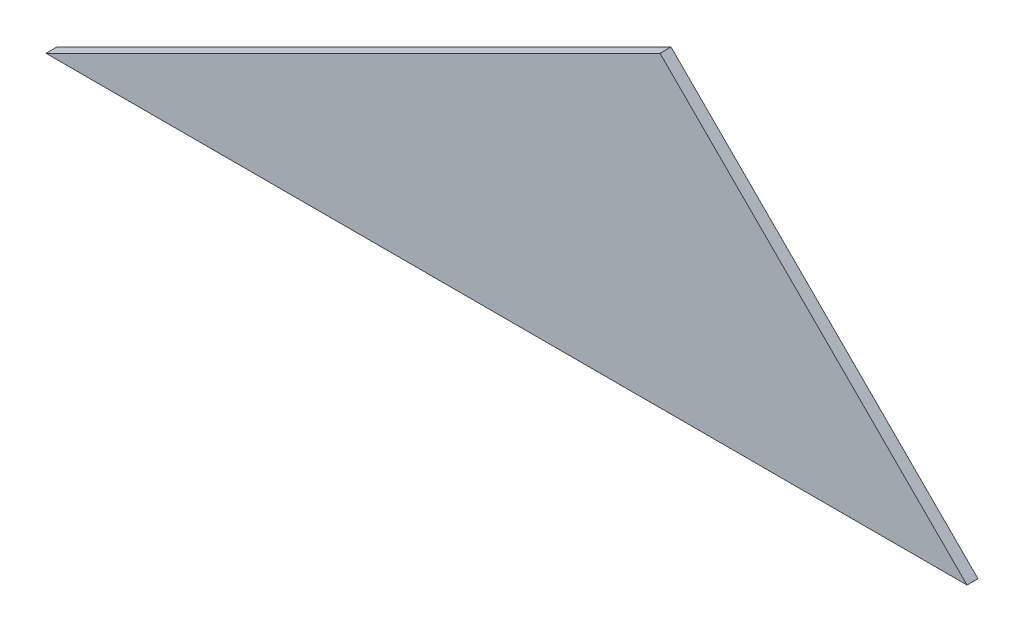
from build123d import *

# Parameters (mm, degrees)
BOSS_EXTRUDE1_DEPTH = 2.5


with BuildPart() as part:
    # Sketch1 → Boss-Extrude1 (new body)
    with BuildSketch(Plane.XY):
        Polygon((0, 0), (210, 0), (140, 70), align=None)
    extrude(amount=BOSS_EXTRUDE1_DEPTH)


solid = part.part
